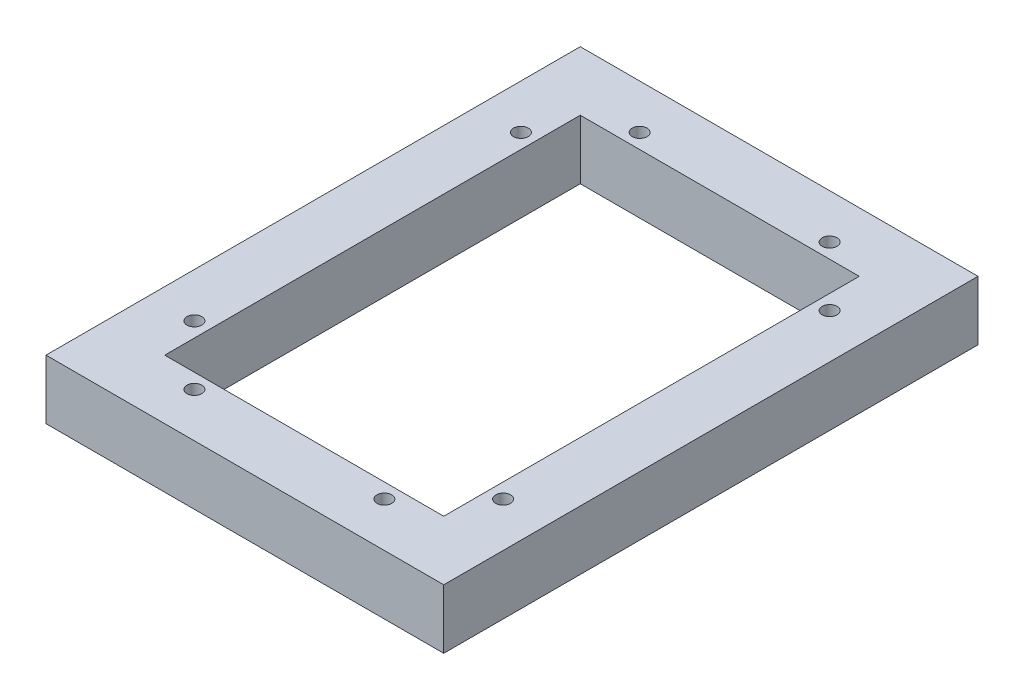
from build123d import *

# Parameters (mm, degrees)
SKETCH2_W               = 170.18
SKETCH2_H               = 228.6
SKETCH2_W_2             = 119.38
SKETCH2_H_2             = 177.8
BOSS_EXTRUDE1_DEPTH     = 25.4
CUT_EXTRUDE1_REACH      = 146.741
SKETCH3_R               = 3.175
MIRROR2_COPY_1_REACH    = 146.741
MIRROR2_COPY_1_SKETCH_R = 3.175


with BuildPart() as part:
    # Sketch2 → Boss-Extrude1 (new body)
    with BuildSketch(Plane(origin=(0, 0, 0), x_dir=(1, 0, 0), z_dir=(0, 1, 0))):
        Rectangle(SKETCH2_W, SKETCH2_H)
        Rectangle(SKETCH2_W_2, SKETCH2_H_2, mode=Mode.SUBTRACT)
    extrude(amount=BOSS_EXTRUDE1_DEPTH)

    # Sketch3 → Cut-Extrude1 (cut, up to next)
    with BuildSketch(Plane(origin=(0, 25.4, 0), x_dir=(1, 0, 0), z_dir=(0, 1, 0)), mode=Mode.PRIVATE) as cut_extrude1_sk1:
        with Locations(Location((-66.04, 69.85, 0), (0, 0, 270))):
            Circle(SKETCH3_R)
    cut_extrude1_tool1 = extrude(cut_extrude1_sk1.sketch, amount=-CUT_EXTRUDE1_REACH, mode=Mode.PRIVATE) & part.part
    # Sketch3 → Cut-Extrude1 (cut, up to next)
    with BuildSketch(Plane(origin=(0, 25.4, 0), x_dir=(1, 0, 0), z_dir=(0, 1, 0)), mode=Mode.PRIVATE) as cut_extrude1_sk2:
        with Locations(Location((-40.64, 95.25, 0), (0, 0, 270))):
            Circle(SKETCH3_R)
    cut_extrude1_tool2 = extrude(cut_extrude1_sk2.sketch, amount=-CUT_EXTRUDE1_REACH, mode=Mode.PRIVATE) & part.part
    cut_extrude1_1 = cut_extrude1_tool1.solids().sort_by_distance((-66.04, 25.4, -69.85))[0]
    add(cut_extrude1_1, mode=Mode.SUBTRACT)
    cut_extrude1_2 = cut_extrude1_tool2.solids().sort_by_distance((-40.64, 25.4, -95.25))[0]
    add(cut_extrude1_2, mode=Mode.SUBTRACT)
    cut_extrude1 = cut_extrude1_1 + cut_extrude1_2  # Cut-Extrude1 as one shape, for the pattern or mirror that repeats it

    # Mirror1: Cut-Extrude1 across plane
    add(cut_extrude1.mirror(Plane(origin=(0, 0, 0), x_dir=(0, 0, 1), z_dir=(1, 0, 0))), mode=Mode.SUBTRACT)

    # Mirror2: Cut-Extrude1 across plane
    add(cut_extrude1.mirror(Plane.XY), mode=Mode.SUBTRACT)

    # Mirror2 copy 1 sketch → Mirror2 copy 1 (cut, up to next)
    with BuildSketch(Plane(origin=(0, 25.4, 0), x_dir=(-1, 0, 0), z_dir=(0, 1, 0)), mode=Mode.PRIVATE) as mirror2_copy_1_sk1:
        with Locations(Location((-66.04, 69.85, 0), (0, 0, 270))):
            Circle(MIRROR2_COPY_1_SKETCH_R)
    mirror2_copy_1_tool1 = extrude(mirror2_copy_1_sk1.sketch, amount=-MIRROR2_COPY_1_REACH, mode=Mode.PRIVATE) & part.part
    # Mirror2 copy 1 sketch → Mirror2 copy 1 (cut, up to next)
    with BuildSketch(Plane(origin=(0, 25.4, 0), x_dir=(-1, 0, 0), z_dir=(0, 1, 0)), mode=Mode.PRIVATE) as mirror2_copy_1_sk2:
        with Locations(Location((-40.64, 95.25, 0), (0, 0, 270))):
            Circle(MIRROR2_COPY_1_SKETCH_R)
    mirror2_copy_1_tool2 = extrude(mirror2_copy_1_sk2.sketch, amount=-MIRROR2_COPY_1_REACH, mode=Mode.PRIVATE) & part.part
    add(mirror2_copy_1_tool1.solids().sort_by_distance((66.04, 25.4, 69.85))[0], mode=Mode.SUBTRACT)
    add(mirror2_copy_1_tool2.solids().sort_by_distance((40.64, 25.4, 95.25))[0], mode=Mode.SUBTRACT)


solid = part.part
